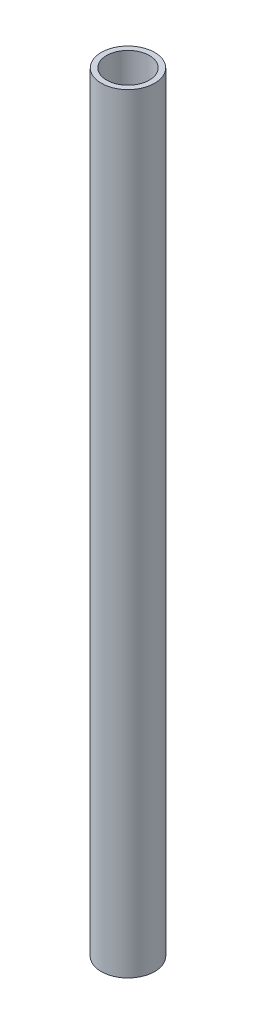
from build123d import *

# Parameters (mm, degrees)
SKETCH1_R           = 15.875
SKETCH1_R_2         = 12.7
BOSS_EXTRUDE1_DEPTH = 228.6


with BuildPart() as part:
    # Sketch1 → Boss-Extrude1 (new, symmetric)
    with BuildSketch(Plane(origin=(0, 0, 0), x_dir=(1, 0, 0), z_dir=(0, 1, 0))):
        with Locations(Location((0, 0, 0), (0, 0, 270))):
            Circle(SKETCH1_R)
        with Locations(Location((0, 0, 0), (0, 0, 270))):
            Circle(SKETCH1_R_2, mode=Mode.SUBTRACT)
    extrude(amount=BOSS_EXTRUDE1_DEPTH, both=True)


solid = part.part
